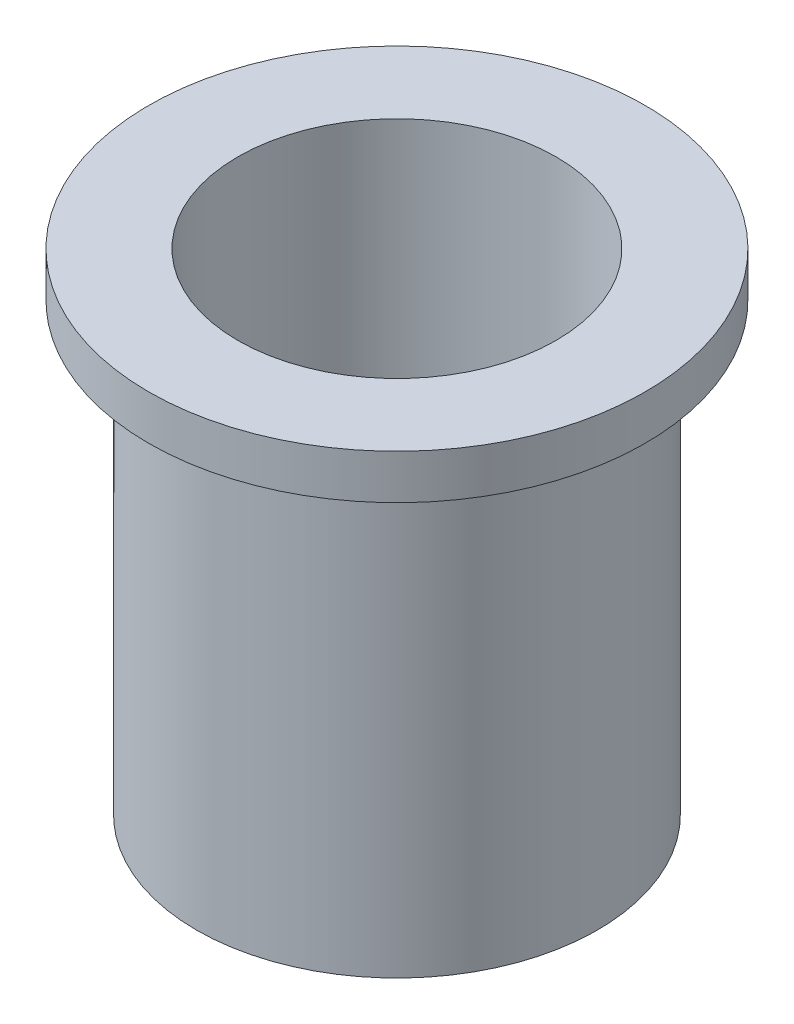
from build123d import *


with BuildPart() as part:
    # Sketch1 → Revolve1 (revolve)
    with BuildSketch(Plane.XY, mode=Mode.PRIVATE) as revolve1_sk:
        Polygon((7.14375, -11), (7.14375, 11), (11.14375, 11), (11.14375, 9), (9, 9), (9, -11), align=None)
    revolve(revolve1_sk.sketch.rotate(Axis((0, 24.995105126, 0), (0, -1, 0)), 90), axis=Axis((0, 24.995105126, 0), (0, -1, 0)))


solid = part.part
